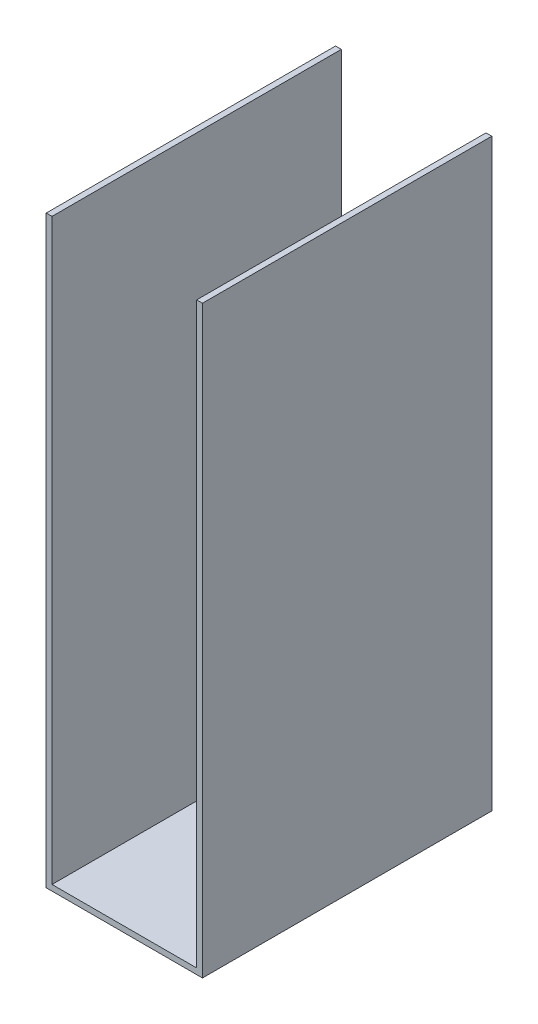
from build123d import *

# Parameters (mm, degrees)
BOSS_EXTRUDE1_DEPTH = 10000


with BuildPart() as part:
    # Sketch2 → Boss-Extrude1 (new body)
    with BuildSketch(Plane.XY):
        Polygon((0, 0), (0, -20000), (5000, -20000), (5000, 0), (5200, 0), (5200, -20200), (-200, -20200), (-200, 0), align=None)
    extrude(amount=BOSS_EXTRUDE1_DEPTH)


solid = part.part
